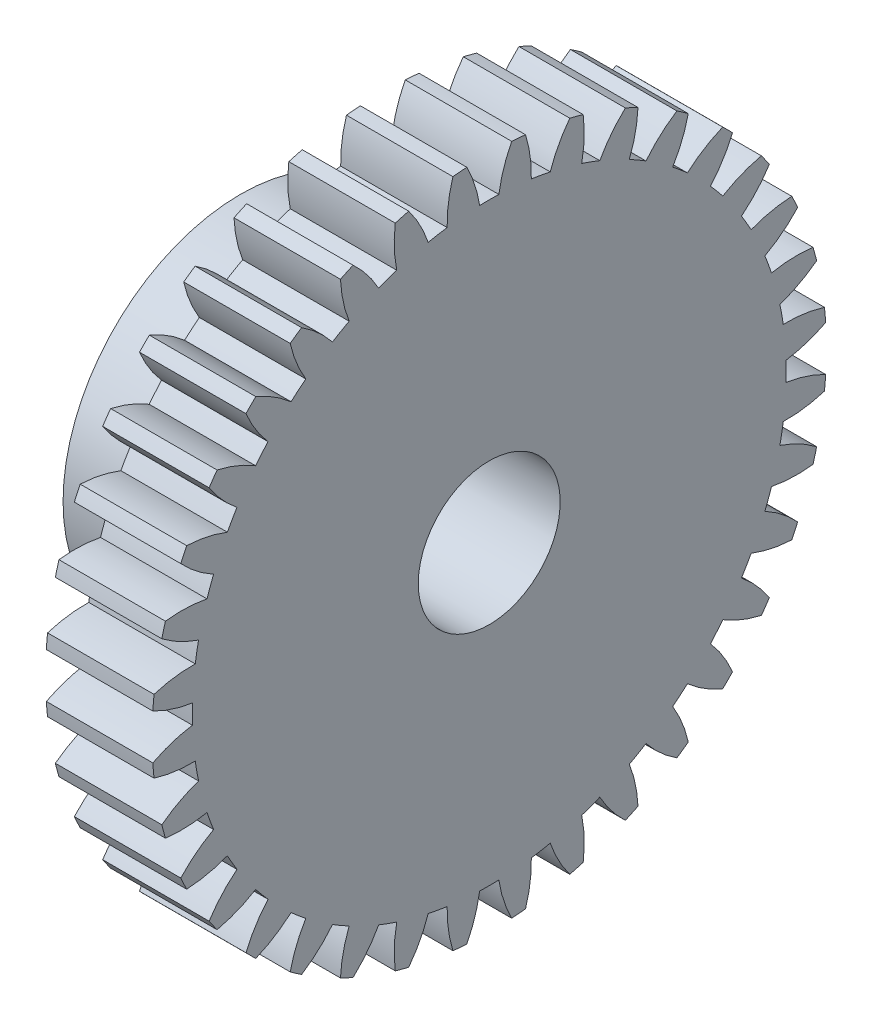
from build123d import *

# Parameters (mm, degrees)
BASPROSKE_W      = 4.7625
BASPROSKE_H      = 15.08125
TOOTHCUT_DEPTH   = 22.853366088
TEETHCUTS_COUNT  = 36
TEETHCUTS_ANGLE  = 350
HUBNEAONESKE_R   = 7.9375
HUBNEARONE_DEPTH = 6.3627508
BORSKE_R         = 3.175
BORE_DEPTH       = 11.1252508


with BuildPart() as part:
    # BasProSke → Base-Revolve (revolve)
    with BuildSketch(Plane(origin=(0, 0, 0), x_dir=(1, 0, 0), z_dir=(0, 1, 0)), mode=Mode.PRIVATE) as base_revolve_sk:
        with Locations((2.38125, 7.540625)):
            Rectangle(BASPROSKE_W, BASPROSKE_H)
    revolve(base_revolve_sk.sketch.rotate(Axis((-10, 0, 0), (1, 0, 0)), 180), axis=Axis((-10, 0, 0), (1, 0, 0)))

    # TooCutSke → ToothCut (cut, through all)
    with BuildSketch(Plane(origin=(0, 0, 0), x_dir=(0, 0, -1), z_dir=(1, 0, 0))):
        with BuildLine():
            ThreePointArc((0.4301327, 13.277234482), (0, 13.2842), (-0.4301327, 13.277234482))
            ThreePointArc((-0.4301327, 13.277234482), (-0.648783493, 14.19921433), (-1.016767835, 15.072393884))
            ThreePointArc((-1.016767835, 15.072393884), (0, 15.10665), (1.016767835, 15.072393884))
            ThreePointArc((1.016767835, 15.072393884), (0.648783493, 14.19921433), (0.4301327, 13.277234482))
        make_face()
    toothcut = extrude(amount=TOOTHCUT_DEPTH, mode=Mode.SUBTRACT)

    # TeethCuts: ToothCut ×36 about axis
    teethcuts_axis = Axis((-10, 0, 0), (1, 0, 0))
    for i in range(1, TEETHCUTS_COUNT):
        add(toothcut.rotate(teethcuts_axis, i * TEETHCUTS_ANGLE / (TEETHCUTS_COUNT - 1)), mode=Mode.SUBTRACT)

    # HubNeaOneSke → HubNearOne (add)
    with BuildSketch(Plane.ZY):
        with Locations(Location((0, 0, 0), (0, 0, 180))):
            Circle(HUBNEAONESKE_R)
    extrude(amount=HUBNEARONE_DEPTH)

    # BorSke → Bore (cut, symmetric)
    with BuildSketch(Plane(origin=(0, 0, 0), x_dir=(0, 0, -1), z_dir=(1, 0, 0))):
        with Locations(Location((0, 0, 0), (0, 0, 180))):
            Circle(BORSKE_R)
    extrude(amount=BORE_DEPTH, both=True, mode=Mode.SUBTRACT)


solid = part.part
